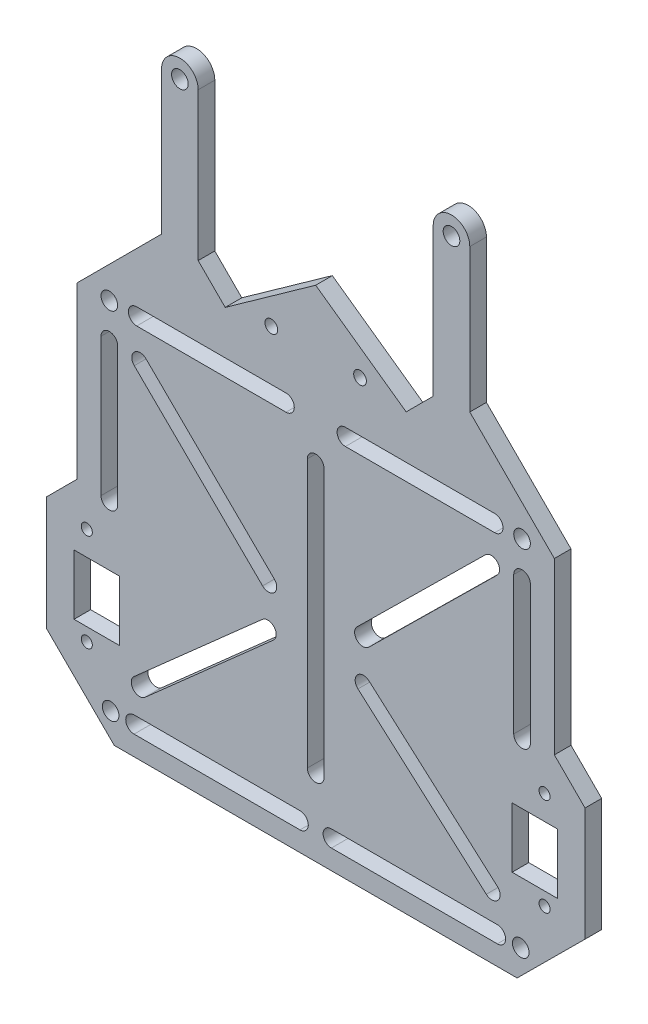
from build123d import *

# Parameters (mm, degrees)
MODEL_R         = 1.5
MODEL_R_2       = 1.15
MODEL_R_3       = 1
MODEL_W         = 8.161843832
MODEL_H         = 10.8383371
EXTRUDE_1_DEPTH = 3


with BuildPart() as part:
    # Model → 凸台-拉伸1 (new body)
    with BuildSketch(Plane.XY):
        with BuildLine():
            Line((-43.059438732, 38.219900225), (-48.592321023, 32.687017934))
            Line((-48.592321023, 32.687017934), (-48.592321023, 12.182501991))
            Line((-48.592321023, 12.182501991), (-36.344324073, 0))
            Line((-36.344324073, 0), (36.344324073, 0))
            Line((36.344324073, 0), (48.592321023, 12.182501991))
            Line((48.592321023, 12.182501991), (48.592321023, 32.687017934))
            Line((48.592321023, 32.687017934), (43.059438732, 38.219900225))
            Line((43.059438732, 38.219900225), (43.059438732, 68.896640242))
            Line((43.059438732, 68.896640242), (27.8, 84.156078975))
            Line((27.8, 84.156078975), (27.8, 110))
            ThreePointArc((27.8, 110), (24.5, 113.3), (21.2, 110))
            Line((21.2, 110), (21.2, 83.314119419))
            Line((21.2, 83.314119419), (16.324508054, 78.438627474))
            Line((16.324508054, 78.438627474), (0, 90.063749844))
            Line((0, 90.063749844), (-16.324508054, 78.438627474))
            Line((-16.324508054, 78.438627474), (-21.2, 83.314119419))
            Line((-21.2, 83.314119419), (-21.2, 110))
            ThreePointArc((-21.2, 110), (-24.5, 113.3), (-27.8, 110))
            Line((-27.8, 110), (-27.8, 84.156078975))
            Line((-27.8, 84.156078975), (-43.059438732, 68.896640242))
            Line((-43.059438732, 68.896640242), (-43.059438732, 38.219900225))
        make_face()
        with Locations((-24.5, 110)):
            Circle(MODEL_R, mode=Mode.SUBTRACT)
        with Locations(Location((8, 79.632653547, 0), (0, 0, 180))):
            Circle(MODEL_R_2, mode=Mode.SUBTRACT)
        with Locations(Location((36.990563228, 5.05084864, 0), (0, 0, 180))):
            Circle(MODEL_R, mode=Mode.SUBTRACT)
        with Locations(Location((37.227006719, 69.050411877, 0), (0, 0, 180))):
            Circle(MODEL_R, mode=Mode.SUBTRACT)
        with Locations((-41.292321023, 13.694034445)):
            Circle(MODEL_R_3, mode=Mode.SUBTRACT)
        with Locations((-41.292321023, 31.294034445)):
            Circle(MODEL_R_3, mode=Mode.SUBTRACT)
        with Locations(Location((41.292321023, 31.294034445, 0), (0, 0, 180))):
            Circle(MODEL_R_3, mode=Mode.SUBTRACT)
        with Locations((-37.227006719, 69.050411877)):
            Circle(MODEL_R, mode=Mode.SUBTRACT)
        with Locations((-36.990563228, 5.05084864)):
            Circle(MODEL_R, mode=Mode.SUBTRACT)
        with Locations(Location((41.292321023, 13.694034445, 0), (0, 0, 180))):
            Circle(MODEL_R_3, mode=Mode.SUBTRACT)
        with Locations((-8, 79.632653547)):
            Circle(MODEL_R_2, mode=Mode.SUBTRACT)
        with Locations(Location((24.5, 110, 0), (0, 0, 180))):
            Circle(MODEL_R, mode=Mode.SUBTRACT)
        with Locations((39.518535679, 21.492278657)):
            Rectangle(MODEL_W, MODEL_H, mode=Mode.SUBTRACT)
        with Locations((-39.518535679, 21.492278657)):
            Rectangle(MODEL_W, MODEL_H, mode=Mode.SUBTRACT)
        with BuildLine():
            Line((-32.294540613, 70.550411877), (-5.361487625, 70.550411877))
            ThreePointArc((-5.361487625, 70.550411877), (-3.861487625, 69.050411877), (-5.361487625, 67.550411877))
            Line((-5.361487625, 67.550411877), (-32.294540613, 67.550411877))
            ThreePointArc((-32.294540613, 67.550411877), (-33.794540613, 69.050411877), (-32.294540613, 70.550411877))
        make_face(mode=Mode.SUBTRACT)
        with BuildLine():
            Line((-35.727006719, 62.728595156), (-35.727006719, 37.828225412))
            ThreePointArc((-35.727006719, 37.828225412), (-37.227006719, 36.328225412), (-38.727006719, 37.828225412))
            Line((-38.727006719, 37.828225412), (-38.727006719, 62.728595156))
            ThreePointArc((-38.727006719, 62.728595156), (-37.227006719, 64.228595156), (-35.727006719, 62.728595156))
        make_face(mode=Mode.SUBTRACT)
        with BuildLine():
            Line((-30.622515674, 63.263136287), (-7.472898393, 40.435705899))
            ThreePointArc((-7.472898393, 40.435705899), (-7.45803348, 38.314437638), (-9.579301741, 38.299572725))
            Line((-9.579301741, 38.299572725), (-32.728919021, 61.127003113))
            ThreePointArc((-32.728919021, 61.127003113), (-32.743783934, 63.248271374), (-30.622515674, 63.263136287))
        make_face(mode=Mode.SUBTRACT)
        with BuildLine():
            Line((-7.627164767, 30.804285944), (-30.776782047, 10.299770001))
            ThreePointArc((-30.776782047, 10.299770001), (-32.894218954, 10.428070228), (-32.765918727, 12.545507134))
            Line((-32.765918727, 12.545507134), (-9.616301447, 33.050023077))
            ThreePointArc((-9.616301447, 33.050023077), (-7.49886454, 32.92172285), (-7.627164767, 30.804285944))
        make_face(mode=Mode.SUBTRACT)
        with BuildLine():
            Line((-32.765918727, 6.55084864), (-2.834717307, 6.55084864))
            ThreePointArc((-2.834717307, 6.55084864), (-1.334717307, 5.05084864), (-2.834717307, 3.55084864))
            Line((-2.834717307, 3.55084864), (-32.765918727, 3.55084864))
            ThreePointArc((-32.765918727, 3.55084864), (-34.265918727, 5.05084864), (-32.765918727, 6.55084864))
        make_face(mode=Mode.SUBTRACT)
        with BuildLine():
            Line((32.765918727, 6.55084864), (2.834717307, 6.55084864))
            ThreePointArc((2.834717307, 6.55084864), (1.334717307, 5.05084864), (2.834717307, 3.55084864))
            Line((2.834717307, 3.55084864), (32.765918727, 3.55084864))
            ThreePointArc((32.765918727, 3.55084864), (34.265918727, 5.05084864), (32.765918727, 6.55084864))
        make_face(mode=Mode.SUBTRACT)
        with BuildLine():
            Line((7.627164767, 30.804285944), (30.776782047, 10.299770001))
            ThreePointArc((30.776782047, 10.299770001), (32.894218954, 10.428070228), (32.765918727, 12.545507134))
            Line((32.765918727, 12.545507134), (9.616301447, 33.050023077))
            ThreePointArc((9.616301447, 33.050023077), (7.49886454, 32.92172285), (7.627164767, 30.804285944))
        make_face(mode=Mode.SUBTRACT)
        with BuildLine():
            Line((35.727006719, 62.728595156), (35.727006719, 37.828225412))
            ThreePointArc((35.727006719, 37.828225412), (37.227006719, 36.328225412), (38.727006719, 37.828225412))
            Line((38.727006719, 37.828225412), (38.727006719, 62.728595156))
            ThreePointArc((38.727006719, 62.728595156), (37.227006719, 64.228595156), (35.727006719, 62.728595156))
        make_face(mode=Mode.SUBTRACT)
        with BuildLine():
            Line((30.622515674, 63.263136287), (7.472898393, 40.435705899))
            ThreePointArc((7.472898393, 40.435705899), (7.45803348, 38.314437638), (9.579301741, 38.299572725))
            Line((9.579301741, 38.299572725), (32.728919021, 61.127003113))
            ThreePointArc((32.728919021, 61.127003113), (32.743783934, 63.248271374), (30.622515674, 63.263136287))
        make_face(mode=Mode.SUBTRACT)
        with BuildLine():
            Line((32.294540613, 70.550411877), (5.361487625, 70.550411877))
            ThreePointArc((5.361487625, 70.550411877), (3.861487625, 69.050411877), (5.361487625, 67.550411877))
            Line((5.361487625, 67.550411877), (32.294540613, 67.550411877))
            ThreePointArc((32.294540613, 67.550411877), (33.794540613, 69.050411877), (32.294540613, 70.550411877))
        make_face(mode=Mode.SUBTRACT)
        with BuildLine():
            Line((1.5, 62.1950697), (1.5, 13.888925857))
            ThreePointArc((1.5, 13.888925857), (0, 12.388925857), (-1.5, 13.888925857))
            Line((-1.5, 13.888925857), (-1.5, 62.1950697))
            ThreePointArc((-1.5, 62.1950697), (0, 63.6950697), (1.5, 62.1950697))
        make_face(mode=Mode.SUBTRACT)
    extrude(amount=EXTRUDE_1_DEPTH)


solid = part.part
